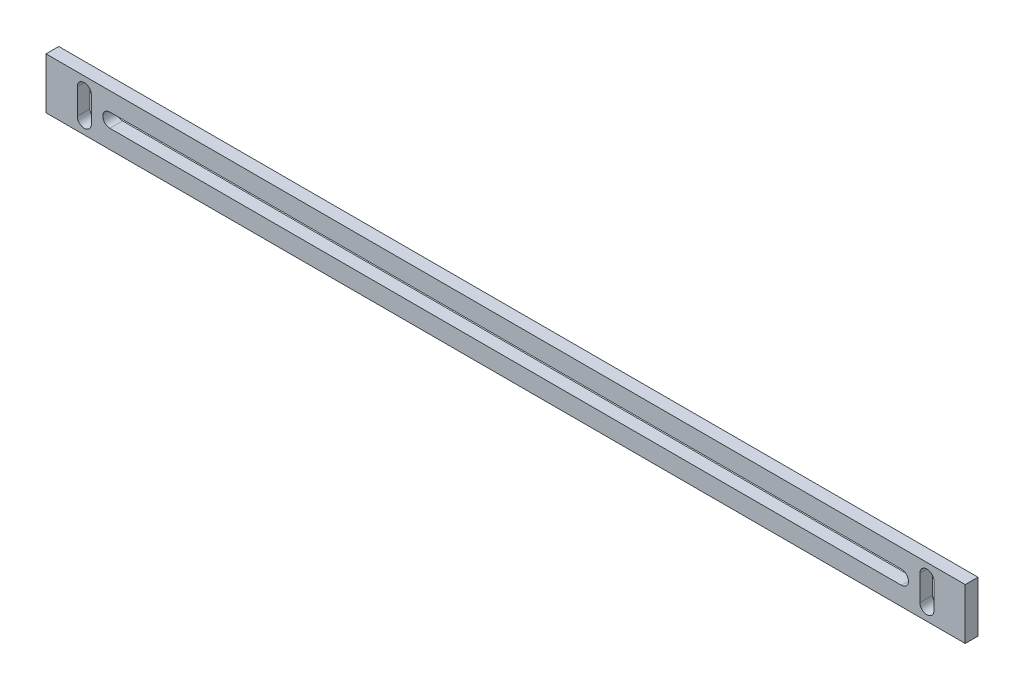
from build123d import *

# Parameters (mm, degrees)
EXTRUDE_1_DEPTH     = 5
CUT_EXTRUDE_1_DEPTH = 5
SKETCH_4_W          = 5
SKETCH_4_H          = 20
EXTRUDE_2_DEPTH     = 5


with BuildPart() as part:
    # 草图1 → 凸台-拉伸1 (new body)
    with BuildSketch(Plane.XY):
        Polygon((175, 10), (0, 10), (-175, 10), (-175, -10), (175, -10), align=None)
    extrude(amount=EXTRUDE_1_DEPTH)

    # 草图3 → 切除-拉伸1 (cut)
    with BuildSketch(Plane(origin=(0, 0, 0), x_dir=(-1, 0, 0), z_dir=(0, 0, -1))):
        with BuildLine():
            Line((-165, 5), (-165, 0))
            Line((-165, 0), (-162.25, 0))
            Line((-162.25, 0), (-162.25, 5))
            ThreePointArc((-162.25, 5), (-163.055456352, 6.944543648), (-165, 7.75))
            Line((-165, 7.75), (-165, 5))
        make_face()
        with BuildLine():
            Line((-167.75, 5), (-167.75, 0))
            Line((-167.75, 0), (-165, 0))
            Line((-165, 0), (-165, 5))
            Line((-165, 5), (-165, 7.75))
            ThreePointArc((-165, 7.75), (-166.944543648, 6.944543648), (-167.75, 5))
        make_face()
        with BuildLine():
            Line((-165, 0), (-167.75, 0))
            Line((-167.75, 0), (-167.75, -5))
            ThreePointArc((-167.75, -5), (-166.944543648, -6.944543648), (-165, -7.75))
            Line((-165, -7.75), (-165, -5))
            Line((-165, -5), (-165, 0))
        make_face()
        with BuildLine():
            Line((-162.25, 0), (-165, 0))
            Line((-165, 0), (-165, -5))
            Line((-165, -5), (-165, -7.75))
            ThreePointArc((-165, -7.75), (-163.055456352, -6.944543648), (-162.25, -5))
            Line((-162.25, -5), (-162.25, 0))
        make_face()
        with BuildLine():
            Line((-155, 0), (-157.75, 0))
            ThreePointArc((-157.75, 0), (-156.944543648, -1.944543648), (-155, -2.75))
            Line((-155, -2.75), (155, -2.75))
            ThreePointArc((155, -2.75), (156.944543648, -1.944543648), (157.75, 0))
            Line((157.75, 0), (155, 0))
            Line((155, 0), (-155, 0))
        make_face()
        with BuildLine():
            ThreePointArc((-155, 2.75), (-156.944543648, 1.944543648), (-157.75, 0))
            Line((-157.75, 0), (-155, 0))
            Line((-155, 0), (155, 0))
            Line((155, 0), (157.75, 0))
            ThreePointArc((157.75, 0), (156.944543648, 1.944543648), (155, 2.75))
            Line((155, 2.75), (-155, 2.75))
        make_face()
        with BuildLine():
            Line((165, 5), (165, 0))
            Line((165, 0), (167.75, 0))
            Line((167.75, 0), (167.75, 5))
            ThreePointArc((167.75, 5), (166.944543648, 6.944543648), (165, 7.75))
            Line((165, 7.75), (165, 5))
        make_face()
        with BuildLine():
            Line((162.25, 5), (162.25, 0))
            Line((162.25, 0), (165, 0))
            Line((165, 0), (165, 5))
            Line((165, 5), (165, 7.75))
            ThreePointArc((165, 7.75), (163.055456352, 6.944543648), (162.25, 5))
        make_face()
        with BuildLine():
            Line((165, 0), (162.25, 0))
            Line((162.25, 0), (162.25, -5))
            ThreePointArc((162.25, -5), (163.055456352, -6.944543648), (165, -7.75))
            Line((165, -7.75), (165, -5))
            Line((165, -5), (165, 0))
        make_face()
        with BuildLine():
            Line((167.75, 0), (165, 0))
            Line((165, 0), (165, -5))
            Line((165, -5), (165, -7.75))
            ThreePointArc((165, -7.75), (166.944543648, -6.944543648), (167.75, -5))
            Line((167.75, -5), (167.75, 0))
        make_face()
    extrude(amount=-CUT_EXTRUDE_1_DEPTH, mode=Mode.SUBTRACT)

    # 草图4 → 凸台-拉伸2 (add)
    with BuildSketch(Plane(origin=(0, 0, 0), x_dir=(-1, 0, 0), z_dir=(0, 0, -1))):
        with Locations((-177.5, 0)):
            Rectangle(SKETCH_4_W, SKETCH_4_H)
        with Locations((177.5, 0)):
            Rectangle(SKETCH_4_W, SKETCH_4_H)
    extrude(amount=-EXTRUDE_2_DEPTH)


solid = part.part
